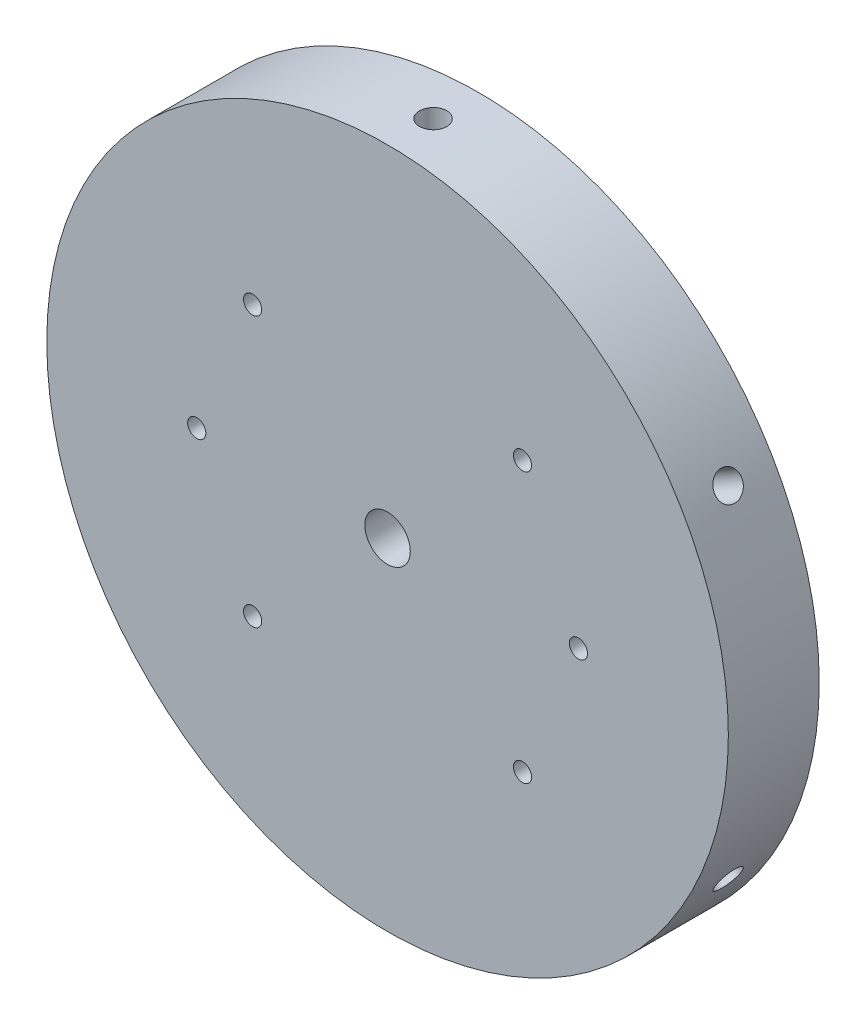
from build123d import *

# Parameters (mm, degrees)
SKETCH_1_R               = 75
EXTRUDE_1_DEPTH          = 20
F_4_0MM_1_D              = 4
PATTERN_CIRCULAR_1_COUNT = 4
PATTERN_CIRCULAR_2_COUNT = 6
CUT_EXTRUDE_1_REACH      = 109.935
SKETCH_7_R               = 5
F_4_0MM_2_D              = 4
PATTERN_CIRCULAR_3_COUNT = 2


with BuildPart() as part:
    # 草圖1 → 填料-伸長1 (new body)
    with BuildSketch(Plane.XY):
        Circle(SKETCH_1_R)
    extrude(amount=EXTRUDE_1_DEPTH)

    # Ø4.0mm 定位孔1 (through all)
    with Locations(Plane.XY.offset(20)):
        with Locations((29.69848481, 29.69848481)):
            f_4_0mm_1 = Hole(F_4_0MM_1_D / 2)

    # 環狀複製排列1: Ø4.0mm 定位孔1 ×4 about axis
    pattern_circular_1_axis = Axis((0, 0, 0), (0, 0, 1))
    for i in range(1, PATTERN_CIRCULAR_1_COUNT):
        add(f_4_0mm_1.rotate(pattern_circular_1_axis, i * 360 / PATTERN_CIRCULAR_1_COUNT), mode=Mode.SUBTRACT)

    # 草圖6 → Ø6.0mm 定位孔1 (revolve, cut)
    with BuildSketch(Plane(origin=(0, 75, 10), x_dir=(0, 0, 1), z_dir=(1, 0, 0))):
        Polygon((0, 0), (0, 21.802581857), (3, 20), (3, 0), align=None)
    f_6_0mm_1 = revolve(axis=Axis((0, 81.35, 10), (0, -1, 0)), mode=Mode.SUBTRACT)

    # 環狀複製排列2: Ø6.0mm 定位孔1 ×6 about axis
    pattern_circular_2_axis = Axis((0, 0, -88.99), (0, 0, 1))
    for i in range(1, PATTERN_CIRCULAR_2_COUNT):
        add(f_6_0mm_1.rotate(pattern_circular_2_axis, i * 360 / PATTERN_CIRCULAR_2_COUNT), mode=Mode.SUBTRACT)

    # 草圖7 → 除料-伸長1 (cut, up to next)
    with BuildSketch(Plane.XY.offset(20), mode=Mode.PRIVATE) as cut_extrude_1_sk1:
        Circle(SKETCH_7_R)
    cut_extrude_1_tool1 = extrude(cut_extrude_1_sk1.sketch, amount=-CUT_EXTRUDE_1_REACH, mode=Mode.PRIVATE) & part.part
    add(cut_extrude_1_tool1.solids().sort_by_distance((0, 0, 20))[0], mode=Mode.SUBTRACT)

    # Ø4.0mm 定位孔2 (through all)
    with Locations(Plane.XY.offset(20)):
        with Locations((-42, 0)):
            f_4_0mm_2 = Hole(F_4_0MM_2_D / 2)

    # 環狀複製排列3: Ø4.0mm 定位孔2 ×2 about axis
    pattern_circular_3_axis = Axis((0, 0, 0), (0, 0, 1))
    for i in range(1, PATTERN_CIRCULAR_3_COUNT):
        add(f_4_0mm_2.rotate(pattern_circular_3_axis, i * 360 / PATTERN_CIRCULAR_3_COUNT), mode=Mode.SUBTRACT)


solid = part.part
